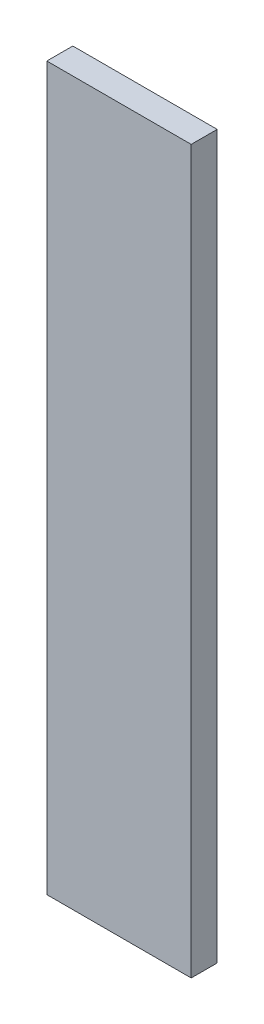
from build123d import *

# Parameters (mm, degrees)
SKETCH1_W           = 100
SKETCH1_H           = 18
BOSS_EXTRUDE1_DEPTH = 500


with BuildPart() as part:
    # Sketch1 → Boss-Extrude1 (new body)
    with BuildSketch(Plane(origin=(0, 0, 0), x_dir=(1, 0, 0), z_dir=(0, 1, 0))):
        with Locations((50, 9)):
            Rectangle(SKETCH1_W, SKETCH1_H)
    extrude(amount=BOSS_EXTRUDE1_DEPTH)


solid = part.part
